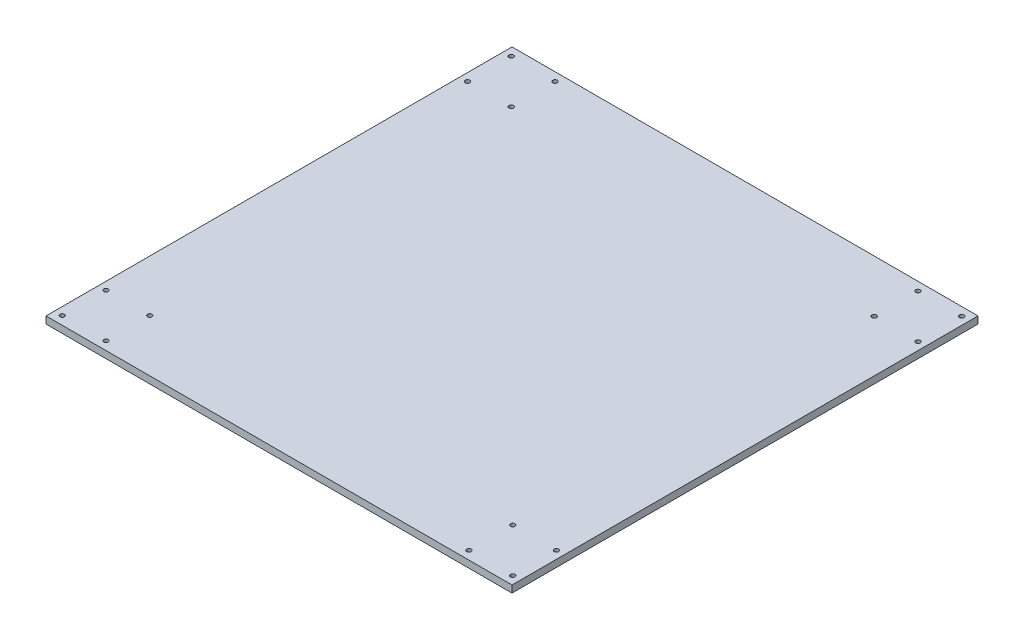
from build123d import *

# Parameters (mm, degrees)
SKETCH_1_W          = 330
SKETCH_1_H          = 330
EXTRUDE_1_DEPTH     = 5
SKETCH_2_R          = 1.6
SKETCH_2_R_2        = 1.602203763
CUT_EXTRUDE_1_DEPTH = 234.39880034


with BuildPart() as part:
    # 草图1 → 凸台-拉伸1 (new body)
    with BuildSketch(Plane(origin=(0, 0, 0), x_dir=(1, 0, 0), z_dir=(0, 1, 0))):
        Rectangle(SKETCH_1_W, SKETCH_1_H)
    extrude(amount=EXTRUDE_1_DEPTH)

    # 草图2 → 切除-拉伸1 (cut, through all)
    with BuildSketch(Plane(origin=(0, 5, 0), x_dir=(1, 0, 0), z_dir=(0, 1, 0))):
        with Locations(Location((-159.5, 159, 0), (0, 0, 270))):
            Circle(SKETCH_2_R)
        with Locations(Location((-128.5, 159, 0), (0, 0, 270))):
            Circle(SKETCH_2_R)
        with Locations(Location((-159.5, 128, 0), (0, 0, 270))):
            Circle(SKETCH_2_R_2)
        with Locations(Location((-128.5, 128, 0), (0, 0, 270))):
            Circle(SKETCH_2_R)
        with Locations(Location((128.5, 159, 0), (0, 0, 270))):
            Circle(SKETCH_2_R)
        with Locations(Location((159.5, 159, 0), (0, 0, 270))):
            Circle(SKETCH_2_R)
        with Locations(Location((128.5, 128, 0), (0, 0, 270))):
            Circle(SKETCH_2_R)
        with Locations(Location((159.5, 128, 0), (0, 0, 270))):
            Circle(SKETCH_2_R)
        with Locations(Location((128.5, -128, 0), (0, 0, 270))):
            Circle(SKETCH_2_R)
        with Locations(Location((159.5, -128, 0), (0, 0, 270))):
            Circle(SKETCH_2_R)
        with Locations(Location((159.5, -159, 0), (0, 0, 270))):
            Circle(SKETCH_2_R)
        with Locations(Location((128.5, -159, 0), (0, 0, 270))):
            Circle(SKETCH_2_R)
        with Locations(Location((-128.5, -159, 0), (0, 0, 270))):
            Circle(SKETCH_2_R)
        with Locations(Location((-159.5, -159, 0), (0, 0, 270))):
            Circle(SKETCH_2_R)
        with Locations(Location((-159.5, -128, 0), (0, 0, 270))):
            Circle(SKETCH_2_R)
        with Locations(Location((-128.5, -128, 0), (0, 0, 270))):
            Circle(SKETCH_2_R)
    extrude(amount=-CUT_EXTRUDE_1_DEPTH, mode=Mode.SUBTRACT)


solid = part.part
